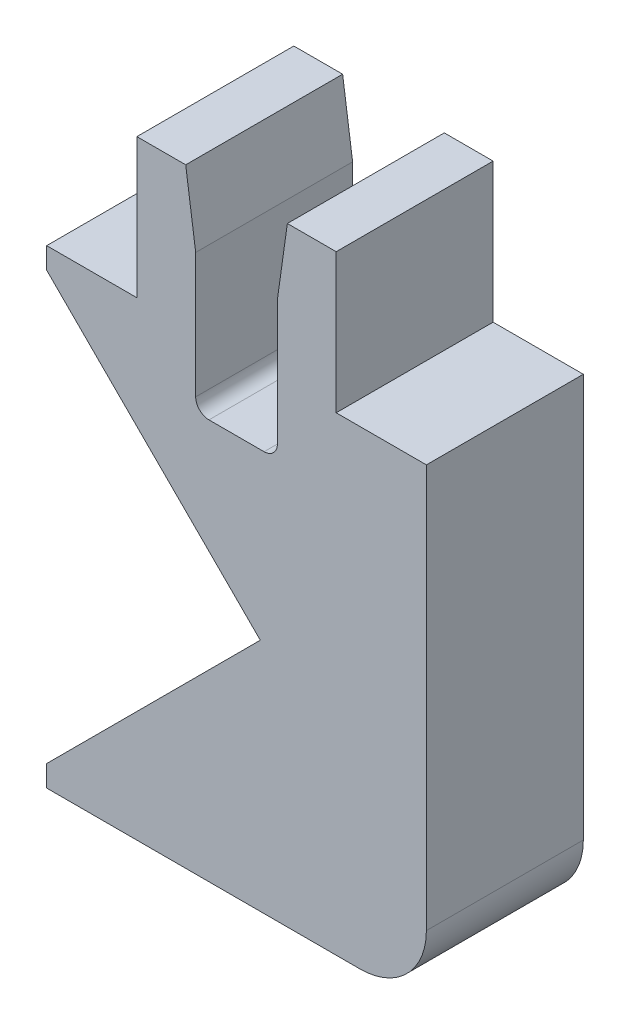
from build123d import *
from OCP.BRepFilletAPI import BRepFilletAPI_MakeChamfer

# Parameters (mm, degrees)
BOSS_EXTRUDE1_DEPTH = 6
FILLET1_R           = 2.54
SKETCH2_W           = 3.1242
SKETCH2_H           = 8.001
CUT_EXTRUDE1_DEPTH  = 18.538679192
CHAMFER1_SIZE       = 0.381
CHAMFER1_SIZE2      = 2.710955864
FILLET2_R           = 0.508


with BuildPart() as part:
    # Sketch1 → Boss-Extrude1 (new body)
    with BuildSketch(Plane.XY):
        Polygon((0, 0), (-8.167456121, 8.167456121), (-8.167456121, 8.980256121), (-4.718728061, 8.980256121), (-4.718728061, 14.314256121), (2.901271939, 14.314256121), (2.901271939, 8.980256121), (6.35, 8.980256121), (6.35, -8.980256121), (-8.167456121, -8.980256121), (-8.167456121, -8.167456121), align=None)
    extrude(amount=BOSS_EXTRUDE1_DEPTH)

    # Fillet1
    fillet1_edges = [part.edges().sort_by_distance(p)[0] for p in [
        (6.35, -8.980256121, 3),
    ]]
    fillet(fillet1_edges, radius=FILLET1_R)

    # Sketch2 → Cut-Extrude1 (cut, through all)
    with BuildSketch(Plane.XY.offset(6)):
        with Locations((-0.908728061, 10.313756121)):
            Rectangle(SKETCH2_W, SKETCH2_H)
    extrude(amount=-CUT_EXTRUDE1_DEPTH, mode=Mode.SUBTRACT)

    # Chamfer1: one chamfer whose edges measure the first distance from different faces: ONE call of the kernel's chamfer builder (chamfer() names one face for all edges)
    chamfer1_edges_1 = [part.edges().sort_by_distance(p)[0] for p in [
        (-2.470828061, 14.314256121, 3),
    ]]
    chamfer1_side_1 = [part.faces().sort_by_distance(p)[0] for p in [
        (-3.594778061, 14.314256121, 3),
    ]]
    chamfer1_edges_2 = [part.edges().sort_by_distance(p)[0] for p in [
        (0.653371939, 14.314256121, 3),
    ]]
    chamfer1_side_2 = [part.faces().sort_by_distance(p)[0] for p in [
        (1.777321939, 14.314256121, 3),
    ]]
    chamfer1 = BRepFilletAPI_MakeChamfer(part.part.solid().wrapped)
    for e in chamfer1_edges_1:
        chamfer1.Add(CHAMFER1_SIZE, CHAMFER1_SIZE2, e.wrapped, chamfer1_side_1[0].wrapped)  # the first distance lies on this face
    for e in chamfer1_edges_2:
        chamfer1.Add(CHAMFER1_SIZE, CHAMFER1_SIZE2, e.wrapped, chamfer1_side_2[0].wrapped)  # the first distance lies on this face
    add(Compound.cast(chamfer1.Shape()), mode=Mode.REPLACE)

    # Fillet2
    fillet2_edges = [part.edges().sort_by_distance(p)[0] for p in [
        (-2.470828061, 6.313256121, 3),
        (0.653371939, 6.313256121, 3),
    ]]
    fillet(fillet2_edges, radius=FILLET2_R)


solid = part.part
